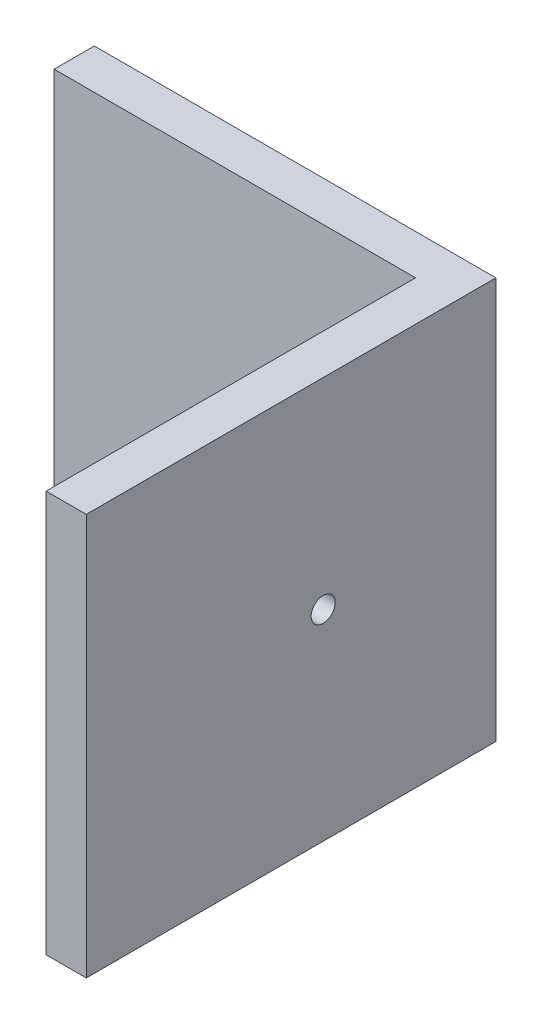
from build123d import *

# Parameters (mm, degrees)
EXTRUDE_1_DEPTH     = 5
EXTRUDE_2_DEPTH     = 51
SKETCH_2_R          = 1.5
CUT_EXTRUDE_1_DEPTH = 10


with BuildPart() as part:
    # ｽｹｯﾁ1 → ﾎﾞｽ - 押し出し1 (new body)
    with BuildSketch(Plane.XY):
        Polygon((20, -25), (20, 0), (20, 25), (-25, 25), (-25, -25), align=None)
        with BuildLine():
            ThreePointArc((8, 0), (9.5, 1.5), (11, 0))
            ThreePointArc((11, 0), (9.5, -1.5), (8, 0))
        make_face(mode=Mode.SUBTRACT)
    extrude(amount=EXTRUDE_1_DEPTH)

    # ｽｹｯﾁ1<4> → ﾎﾞｽ - 押し出し2 (add)
    with BuildSketch(Plane.XY):
        Polygon((20, 25), (20, 0), (20, -25), (25, -25), (25, 25), align=None)
    extrude(amount=EXTRUDE_2_DEPTH)

    # ｽｹｯﾁ2 → ｶｯﾄ - 押し出し1 (cut)
    with BuildSketch(Plane.ZY.offset(-20)):
        with Locations((21.5, 0)):
            Circle(SKETCH_2_R)
    extrude(amount=-CUT_EXTRUDE_1_DEPTH, mode=Mode.SUBTRACT)


solid = part.part
